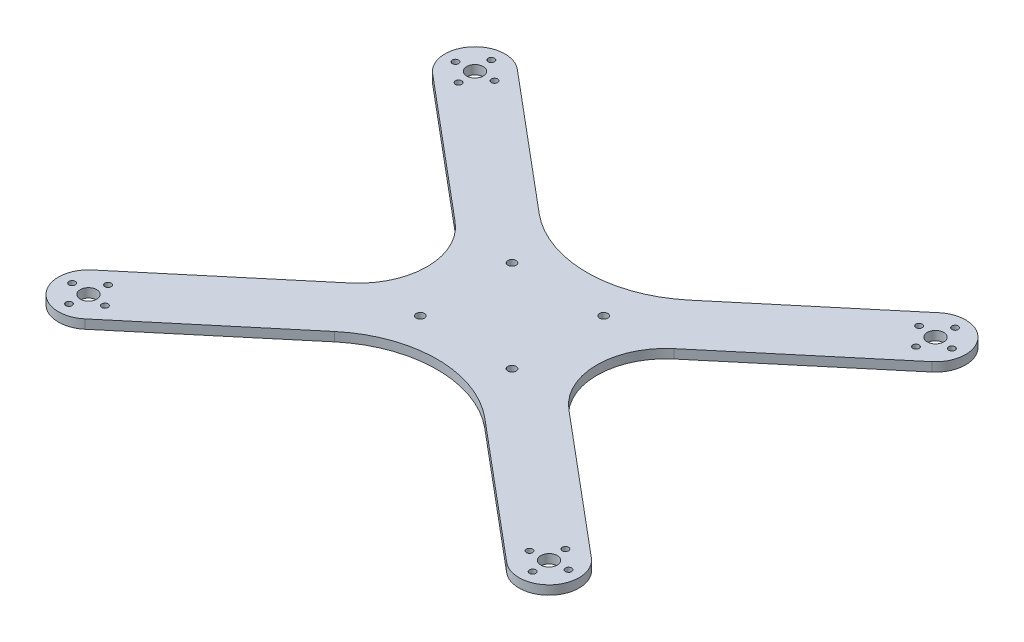
from build123d import *

# Parameters (mm, degrees)
SKETCH2_R           = 1.05
SKETCH2_R_2         = 2.75
BOSS_EXTRUDE2_DEPTH = 3
SKETCH4_R           = 1.375
CUT_EXTRUDE1_DEPTH  = 3


with BuildPart() as part:
    # Sketch2 → Boss-Extrude2 (new body)
    with BuildSketch(Plane(origin=(0, 0, 0), x_dir=(1, 0, 0), z_dir=(0, 1, 0))):
        with BuildLine():
            Line((-83.032320409, 56.618316537), (-36.412926139, 17.5))
            ThreePointArc((-36.412926139, 17.5), (-28.252542121, 0), (-36.412926139, -17.5))
            Line((-36.412926139, -17.5), (-83.032320409, -56.618316537))
            ThreePointArc((-83.032320409, -56.618316537), (-84.264888743, -70.706637066), (-70.176568215, -71.9392054))
            Line((-70.176568215, -71.9392054), (-25, -34.031563673))
            ThreePointArc((-25, -34.031563673), (0, -24.932307816), (25, -34.031563673))
            Line((25, -34.031563673), (70.176568215, -71.9392054))
            ThreePointArc((70.176568215, -71.9392054), (84.264888743, -70.706637066), (83.032320409, -56.618316537))
            Line((83.032320409, -56.618316537), (36.412926139, -17.5))
            ThreePointArc((36.412926139, -17.5), (28.252542121, 0), (36.412926139, 17.5))
            Line((36.412926139, 17.5), (83.032320409, 56.618316537))
            ThreePointArc((83.032320409, 56.618316537), (84.264888743, 70.706637066), (70.176568215, 71.9392054))
            Line((70.176568215, 71.9392054), (25, 34.031563673))
            ThreePointArc((25, 34.031563673), (0, 24.932307816), (-25, 34.031563673))
            Line((-25, 34.031563673), (-70.176568215, 71.9392054))
            ThreePointArc((-70.176568215, 71.9392054), (-84.264888743, 70.706637066), (-83.032320409, 56.618316537))
        make_face()
        with Locations(Location((-77.127378768, 70.255929157, 0), (0, 0, 270))):
            Circle(SKETCH2_R, mode=Mode.SUBTRACT)
        with Locations(Location((-70.627276123, 64.801695425, 0), (0, 0, 270))):
            Circle(SKETCH2_R, mode=Mode.SUBTRACT)
        with Locations(Location((-76.081509855, 58.30159278, 0), (0, 0, 270))):
            Circle(SKETCH2_R, mode=Mode.SUBTRACT)
        with Locations(Location((-82.5816125, 63.755826512, 0), (0, 0, 270))):
            Circle(SKETCH2_R, mode=Mode.SUBTRACT)
        with Locations(Location((-76.604444312, 64.278760969, 0), (0, 0, 270))):
            Circle(SKETCH2_R_2, mode=Mode.SUBTRACT)
        with Locations(Location((-77.127378768, -70.255929157, 0), (0, 0, 90))):
            Circle(SKETCH2_R, mode=Mode.SUBTRACT)
        with Locations(Location((-76.081509855, -58.30159278, 0), (0, 0, 90))):
            Circle(SKETCH2_R, mode=Mode.SUBTRACT)
        with Locations(Location((-82.5816125, -63.755826512, 0), (0, 0, 90))):
            Circle(SKETCH2_R, mode=Mode.SUBTRACT)
        with Locations(Location((-76.604444312, -64.278760969, 0), (0, 0, 90))):
            Circle(SKETCH2_R_2, mode=Mode.SUBTRACT)
        with Locations(Location((-70.627276123, -64.801695425, 0), (0, 0, 90))):
            Circle(SKETCH2_R, mode=Mode.SUBTRACT)
        with Locations(Location((70.627276123, -64.801695425, 0), (0, 0, 270))):
            Circle(SKETCH2_R, mode=Mode.SUBTRACT)
        with Locations(Location((76.604444312, -64.278760969, 0), (0, 0, 270))):
            Circle(SKETCH2_R_2, mode=Mode.SUBTRACT)
        with Locations(Location((82.5816125, -63.755826512, 0), (0, 0, 270))):
            Circle(SKETCH2_R, mode=Mode.SUBTRACT)
        with Locations(Location((76.081509855, -58.30159278, 0), (0, 0, 270))):
            Circle(SKETCH2_R, mode=Mode.SUBTRACT)
        with Locations(Location((77.127378768, -70.255929157, 0), (0, 0, 270))):
            Circle(SKETCH2_R, mode=Mode.SUBTRACT)
        with Locations(Location((76.604444312, 64.278760969, 0), (0, 0, 90))):
            Circle(SKETCH2_R_2, mode=Mode.SUBTRACT)
        with Locations(Location((82.5816125, 63.755826512, 0), (0, 0, 90))):
            Circle(SKETCH2_R, mode=Mode.SUBTRACT)
        with Locations(Location((76.081509855, 58.30159278, 0), (0, 0, 90))):
            Circle(SKETCH2_R, mode=Mode.SUBTRACT)
        with Locations(Location((70.627276123, 64.801695425, 0), (0, 0, 90))):
            Circle(SKETCH2_R, mode=Mode.SUBTRACT)
        with Locations(Location((77.127378768, 70.255929157, 0), (0, 0, 90))):
            Circle(SKETCH2_R, mode=Mode.SUBTRACT)
    extrude(amount=BOSS_EXTRUDE2_DEPTH)

    # Sketch4 → Cut-Extrude1 (cut)
    with BuildSketch(Plane(origin=(0, 0, 0), x_dir=(1, 0, 0), z_dir=(0, 1, 0))):
        with Locations(Location((-15.25, 15.25, 0), (0, 0, 270))):
            Circle(SKETCH4_R)
        with Locations(Location((15.25, -15.25, 0), (0, 0, 270))):
            Circle(SKETCH4_R)
        with Locations(Location((-15.25, -15.25, 0), (0, 0, 270))):
            Circle(SKETCH4_R)
        with Locations(Location((15.25, 15.25, 0), (0, 0, 270))):
            Circle(SKETCH4_R)
    extrude(amount=CUT_EXTRUDE1_DEPTH, mode=Mode.SUBTRACT)


solid = part.part
